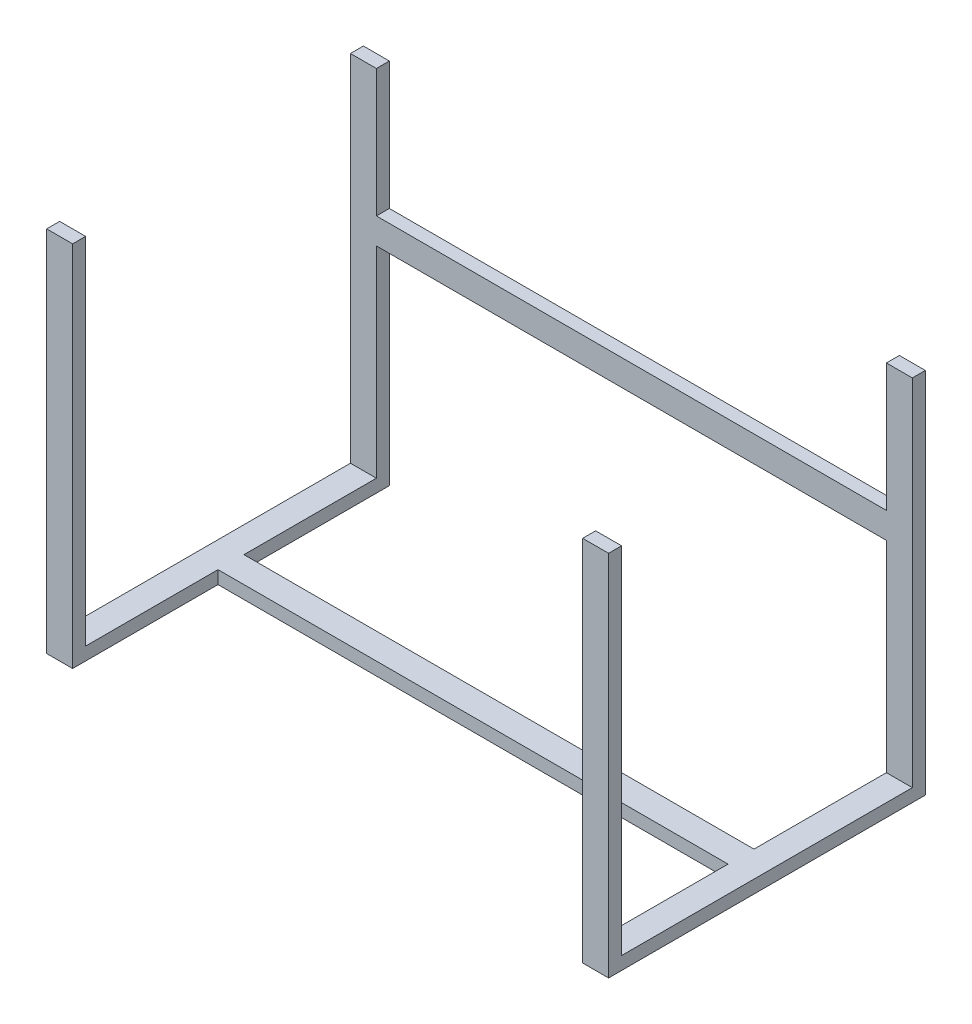
from build123d import *

# Parameters (mm, degrees)
BOSS_EXTRUDE1_DEPTH = 50.8
SKETCH2_W           = 50.8
SKETCH2_H           = 25.4
BOSS_EXTRUDE2_DEPTH = 499.2
SKETCH3_W           = 25.4
SKETCH3_H           = 50.8
BOSS_EXTRUDE3_DEPTH = 998.4


with BuildPart() as part:
    # Sketch1 → Boss-Extrude1 (new body)
    with BuildSketch(Plane(origin=(0, 0, 0), x_dir=(0, 0, -1), z_dir=(1, 0, 0))):
        Polygon((0, 720), (0, 0), (-620, 0), (-620, 720), (-594.6, 720), (-594.6, 25.4), (-25.4, 25.4), (-25.4, 720), align=None)
    boss_extrude1 = extrude(amount=BOSS_EXTRUDE1_DEPTH)

    # Sketch2 → Boss-Extrude2 (add)
    with BuildSketch(Plane(origin=(50.8, 0, 0), x_dir=(0, 0, -1), z_dir=(1, 0, 0))):
        with Locations((-310, 12.7)):
            Rectangle(SKETCH2_W, SKETCH2_H)
    boss_extrude2 = extrude(amount=BOSS_EXTRUDE2_DEPTH)

    # Mirror1: Boss-Extrude1, Boss-Extrude2 across plane
    add(boss_extrude1.mirror(Plane(origin=(550, 0, 0), x_dir=(0, 0, 1), z_dir=(1, 0, 0))))
    add(boss_extrude2.mirror(Plane(origin=(550, 0, 0), x_dir=(0, 0, 1), z_dir=(1, 0, 0))))

    # Sketch3 → Boss-Extrude3 (add)
    with BuildSketch(Plane(origin=(50.8, 0, 0), x_dir=(0, 0, -1), z_dir=(1, 0, 0))):
        with Locations((-12.7, 444.6)):
            Rectangle(SKETCH3_W, SKETCH3_H)
    extrude(amount=BOSS_EXTRUDE3_DEPTH)


solid = part.part
